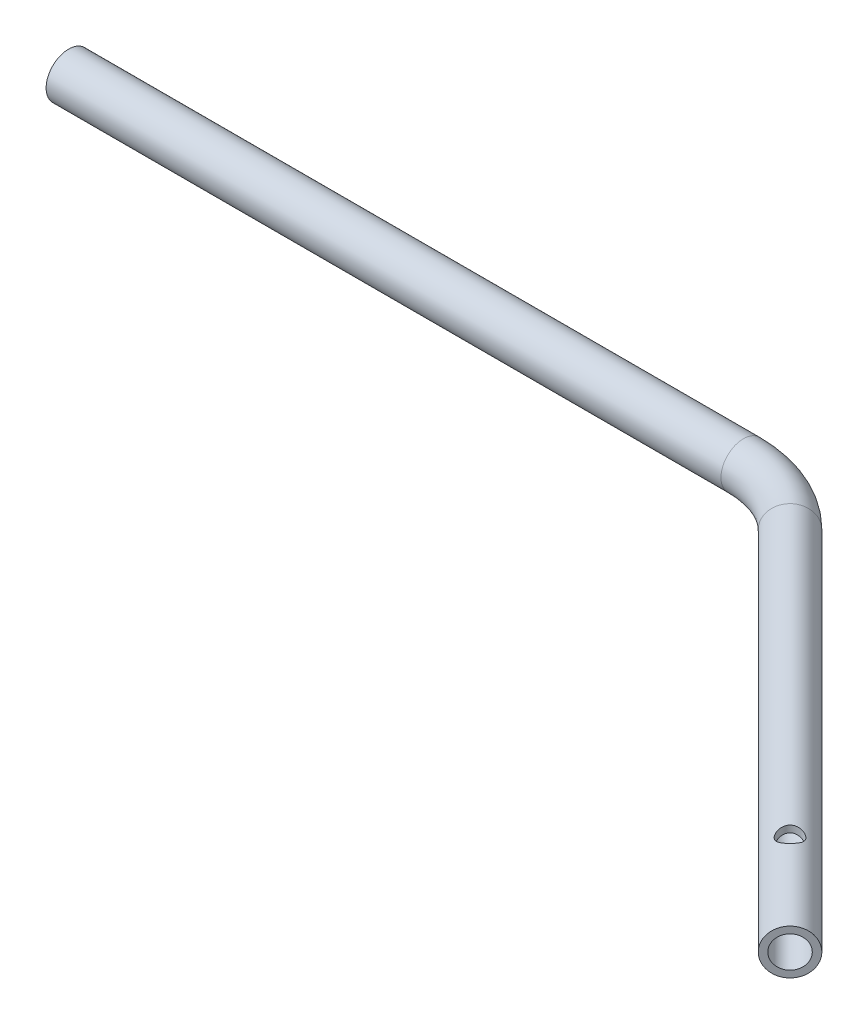
from build123d import *

# Parameters (mm, degrees)
SWEEP_THIN1_PROFILE_R   = 10
SWEEP_THIN1_PROFILE_R_2 = 7
CUT_EXTRUDE1_DEPTH      = 533.134800358
CUT_EXTRUDE1_DEPTH_BACK = 533.134800358
SKETCH22_R              = 5


with BuildPart() as part:
    # Sweep-Thin1: sweep along a path in Sketch1
    with BuildLine(Plane(origin=(0, 0, 0), x_dir=(1, 0, 0), z_dir=(0, 1, 0))) as sweep_thin1_path:
        Line((0, 0), (-162.634559673, 162.634559673))
        ThreePointArc((-162.634559673, 162.634559673), (-178.855727114, 173.473197239), (-197.989898732, 177.279220614))
        Line((-197.989898732, 177.279220614), (-497.989898732, 177.279220614))
    # Sweep-Thin1 profile (on start of the path) → Sweep-Thin1 (sweep)
    with BuildSketch(Plane(origin=(0, 0, 0), x_dir=(-0.7071067811865488, 0, 0.7071067811865464), z_dir=(-0.7071067811865464, 0, -0.7071067811865488))):
        Circle(SWEEP_THIN1_PROFILE_R)
        Circle(SWEEP_THIN1_PROFILE_R_2, mode=Mode.SUBTRACT)
    sweep(path=sweep_thin1_path.line)

    # Sketch22 → Cut-Extrude1 (cut, two sides: drawn at the far end of the back side and taken through both)
    with BuildSketch(Plane(origin=(0, 0, 0), x_dir=(1, 0, 0), z_dir=(0, 1, 0)).offset(-CUT_EXTRUDE1_DEPTH_BACK)):
        with Locations(Location((-35.355339059, 35.355339059, 0), (0, 0, 270))):
            Circle(SKETCH22_R)
    extrude(amount=CUT_EXTRUDE1_DEPTH + CUT_EXTRUDE1_DEPTH_BACK, mode=Mode.SUBTRACT)


solid = part.part
